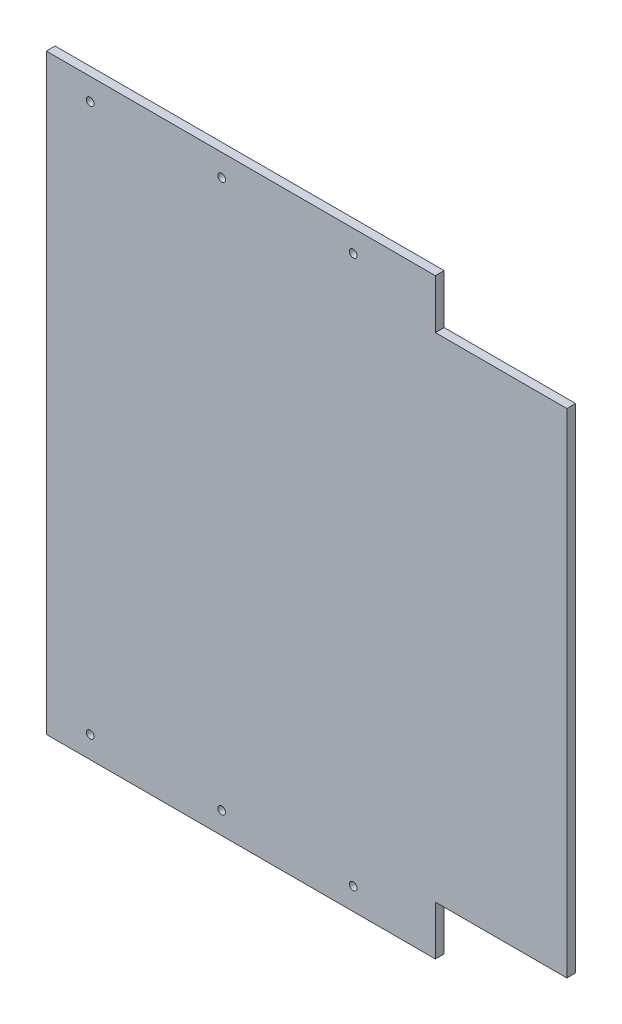
from build123d import *

# Parameters (mm, degrees)
ESQUISSE1_W                  = 475
ESQUISSE1_H                  = 540
BOSS_EXTRU_1_DEPTH           = 8
ENL_V_MAT_EXTRU_1_DEPTH      = 720.228058407
ENL_V_MAT_EXTRU_1_DEPTH_BACK = 720.228058407
ESQUISSE2_R                  = 3.5
ENL_V_MAT_EXTRU_2_DEPTH      = 720.228058407
ENL_V_MAT_EXTRU_2_DEPTH_BACK = 720.228058407
ESQUISSE3_W                  = 120
ESQUISSE3_H                  = 45


with BuildPart() as part:
    # Esquisse1 → Boss.-Extru.1 (new body)
    with BuildSketch(Plane.XY):
        with Locations((237.5, 270)):
            Rectangle(ESQUISSE1_W, ESQUISSE1_H)
    extrude(amount=BOSS_EXTRU_1_DEPTH)

    # Esquisse2 → Enlèv. mat.-Extru.1 (cut, two sides: drawn at the far end of the back side and taken through both)
    with BuildSketch(Plane.XY.offset(8).offset(-ENL_V_MAT_EXTRU_1_DEPTH_BACK)):
        with Locations((160, 520)):
            Circle(ESQUISSE2_R)
        with Locations((40, 520)):
            Circle(ESQUISSE2_R)
        with Locations(Location((400, 520, 0), (0, 0, 180))):
            Circle(ESQUISSE2_R)
        with Locations(Location((280, 520, 0), (0, 0, 180))):
            Circle(ESQUISSE2_R)
        with Locations((280, 20)):
            Circle(ESQUISSE2_R)
        with Locations((400, 20)):
            Circle(ESQUISSE2_R)
        with Locations(Location((40, 20, 0), (0, 0, 180))):
            Circle(ESQUISSE2_R)
        with Locations(Location((160, 20, 0), (0, 0, 180))):
            Circle(ESQUISSE2_R)
    extrude(amount=ENL_V_MAT_EXTRU_1_DEPTH + ENL_V_MAT_EXTRU_1_DEPTH_BACK, mode=Mode.SUBTRACT)

    # Esquisse3 → Enlèv. mat.-Extru.2 (cut, two sides: drawn at the far end of the back side and taken through both)
    with BuildSketch(Plane.XY.offset(8).offset(-ENL_V_MAT_EXTRU_2_DEPTH_BACK)):
        with Locations((415, 517.5)):
            Rectangle(ESQUISSE3_W, ESQUISSE3_H)
        with Locations((415, 22.5)):
            Rectangle(ESQUISSE3_W, ESQUISSE3_H)
    extrude(amount=ENL_V_MAT_EXTRU_2_DEPTH + ENL_V_MAT_EXTRU_2_DEPTH_BACK, mode=Mode.SUBTRACT)


solid = part.part
